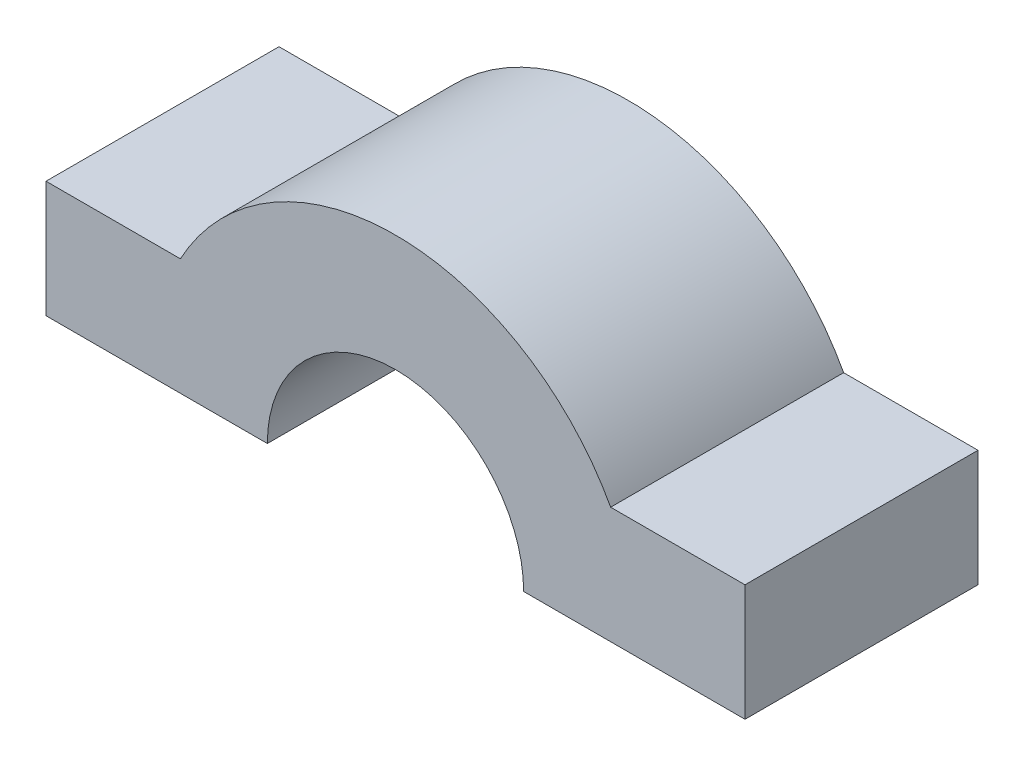
from build123d import *

# Parameters (mm, degrees)
BOSS_EXTRUDE1_DEPTH = 10


with BuildPart() as part:
    # Sketch1 → Boss-Extrude1 (new body)
    with BuildSketch(Plane.XY):
        with BuildLine():
            Line((-15, 0), (-5.5, 0))
            ThreePointArc((-5.5, 0), (0, 5.5), (5.5, 0))
            Line((5.5, 0), (15, 0))
            Line((15, 0), (15, 5))
            Line((15, 5), (9.233092656, 5))
            ThreePointArc((9.233092656, 5), (0, 10.5), (-9.233092656, 5))
            Line((-9.233092656, 5), (-15, 5))
            Line((-15, 5), (-15, 0))
        make_face()
    extrude(amount=BOSS_EXTRUDE1_DEPTH)


solid = part.part
